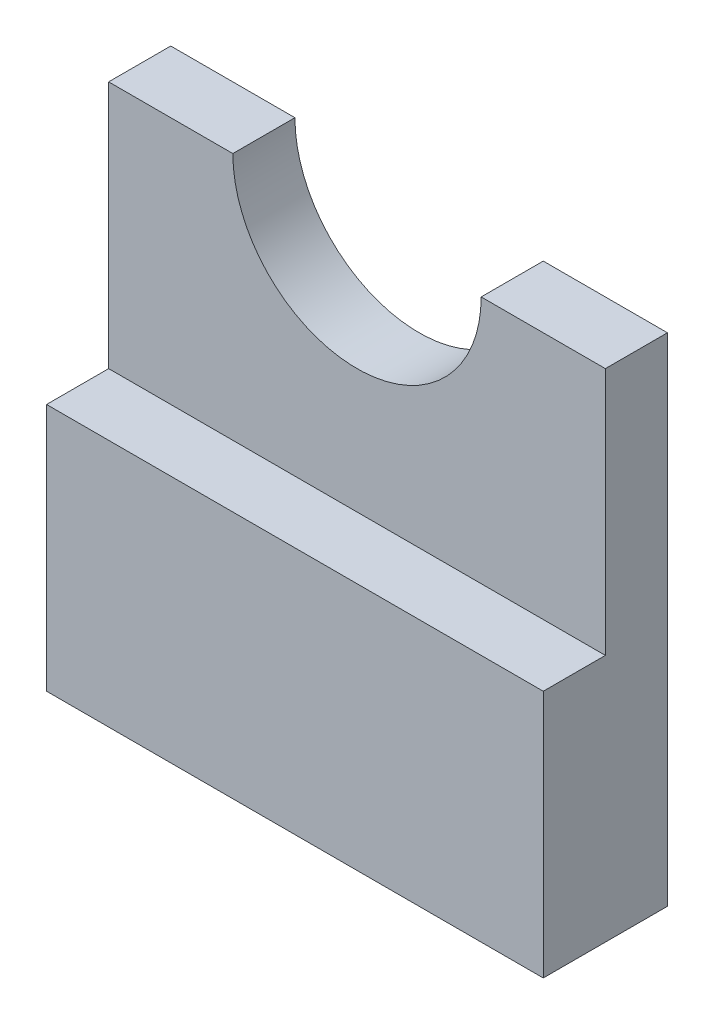
from build123d import *

# Parameters (mm, degrees)
BOSS_EXTRUDE1_DEPTH = 3.175
SKETCH2_W           = 50.8
SKETCH2_H           = 25.4
BOSS_EXTRUDE2_DEPTH = 6.35


with BuildPart() as part:
    # Sketch1 → Boss-Extrude1 (new, symmetric)
    with BuildSketch(Plane.XY):
        with BuildLine():
            Line((12.7, 25.4), (25.4, 25.4))
            Line((25.4, 25.4), (25.4, -25.4))
            Line((25.4, -25.4), (-25.4, -25.4))
            Line((-25.4, -25.4), (-25.4, 25.4))
            Line((-25.4, 25.4), (-12.7, 25.4))
            ThreePointArc((-12.7, 25.4), (0, 12.7), (12.7, 25.4))
        make_face()
    extrude(amount=BOSS_EXTRUDE1_DEPTH, both=True)

    # Sketch2 → Boss-Extrude2 (add)
    with BuildSketch(Plane.XY.offset(3.175)):
        with Locations((0, -12.7)):
            Rectangle(SKETCH2_W, SKETCH2_H)
    extrude(amount=BOSS_EXTRUDE2_DEPTH)


solid = part.part
